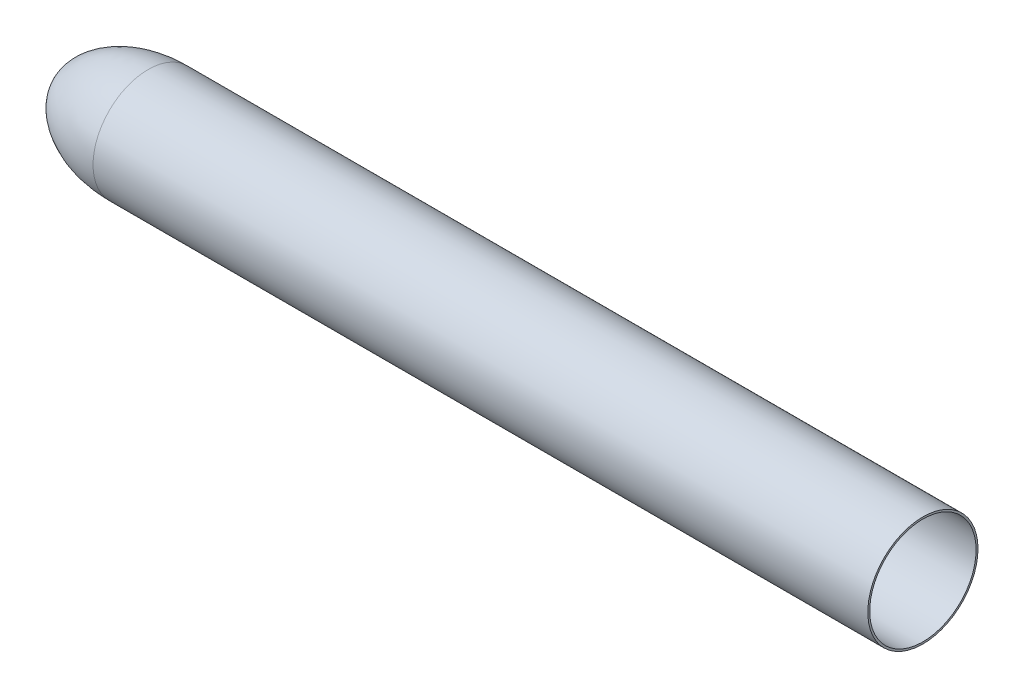
from build123d import *

# Parameters (mm, degrees)
SKETCH1_R                   = 1600
BODY_EXTRUDE_DEPTH          = 22500
ROCKET_TIP_DOME_FACE_RADIUS = 1600
ROCKET_TIP_DOME_HEIGHT      = 2500
SHELL_55MM_T                = -55
SKETCH2_R                   = 1545
SKETCH2_R_2                 = 1400
ENGINE_MOUNT_EXTRUDE_DEPTH  = 300
SLOTS_START                 = 75
SLOTS_DEPTH                 = 75
DOVETAIL_CUT_SLOTS_ANGLE    = 60


with BuildPart() as part:
    # Sketch1 → Body Extrude (new body)
    with BuildSketch(Plane(origin=(0, 0, 0), x_dir=(0, 0, -1), z_dir=(1, 0, 0))):
        Circle(SKETCH1_R)
    extrude(amount=-BODY_EXTRUDE_DEPTH)

    # Rocket Tip Dome: an elliptical dome of height H over a round flat face of radius A is half a spheroid: the quarter ellipse of half axes A and H revolved about the face's axis
    with BuildSketch(Plane((-22500, 0, 0), x_dir=(0, 0, -1), z_dir=(0, 1, 0)), mode=Mode.PRIVATE) as rocket_tip_dome_quarter:
        Ellipse(ROCKET_TIP_DOME_FACE_RADIUS, ROCKET_TIP_DOME_HEIGHT)
        Rectangle(ROCKET_TIP_DOME_FACE_RADIUS, ROCKET_TIP_DOME_HEIGHT, align=(Align.MIN, Align.MIN), mode=Mode.INTERSECT)
    revolve(rocket_tip_dome_quarter.sketch, axis=Axis((-22500, 0, 0), (-1, 0, 0)))

    # Shell = 55mm
    shell_55mm_openings = [part.faces().sort_by_distance(p)[0] for p in [
        (0, 0, 0),
    ]]
    offset(amount=SHELL_55MM_T, openings=shell_55mm_openings, kind=Kind.INTERSECTION)

    # Sketch2 → Engine Mount Extrude (add)
    with BuildSketch(Plane(origin=(-2500, 0, 0), x_dir=(0, 0, -1), z_dir=(1, 0, 0))):
        Circle(SKETCH2_R)
        Circle(SKETCH2_R_2, mode=Mode.SUBTRACT)
    extrude(amount=-ENGINE_MOUNT_EXTRUDE_DEPTH)

    # Sketch3 → Slots (add)
    with BuildSketch(Plane(origin=(-2425, 0, 0), x_dir=(0, 0, -1), z_dir=(1, 0, 0)).offset(SLOTS_START)):
        with BuildLine():
            Line((755, 1307.698359715), (772.5, 1338.009248847))
            ThreePointArc((772.5, 1338.009248847), (0, 1545), (-772.5, 1338.009248847))
            Line((-772.5, 1338.009248847), (-755, 1307.698359715))
            ThreePointArc((-755, 1307.698359715), (0, 1510), (755, 1307.698359715))
        make_face()
        with BuildLine():
            Line((-755, -1307.698359715), (-772.5, -1338.009248847))
            ThreePointArc((-772.5, -1338.009248847), (0, -1545), (772.5, -1338.009248847))
            Line((772.5, -1338.009248847), (755, -1307.698359715))
            ThreePointArc((755, -1307.698359715), (0, -1510), (-755, -1307.698359715))
        make_face()
    extrude(amount=-SLOTS_DEPTH)

    # Sketch13 → Dovetail Cut Slots (revolve, symmetric, cut)
    with BuildSketch(Plane.XY) as dovetail_cut_slots_sk:
        Polygon((-2425, -1545), (-2404.792740578, -1510), (-2425, -1510), align=None)
        Polygon((-2350, -1510), (-2350, -1545), (-2370.207259422, -1510), align=None)
    revolve(axis=Axis((0, 0, 0), (-1, 0, 0)), revolution_arc=DOVETAIL_CUT_SLOTS_ANGLE / 2, mode=Mode.SUBTRACT)
    revolve(dovetail_cut_slots_sk.sketch, axis=Axis((0, 0, 0), (1, 0, 0)), revolution_arc=DOVETAIL_CUT_SLOTS_ANGLE / 2, mode=Mode.SUBTRACT)


solid = part.part
